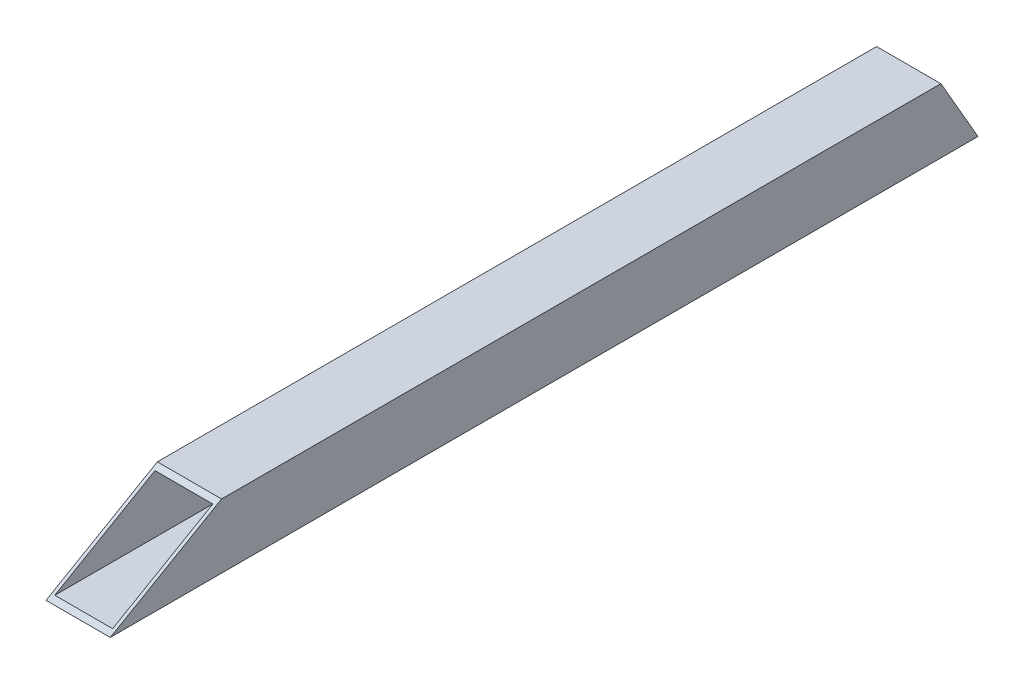
from build123d import *

# Parameters (mm, degrees)
SKETCH_1_W          = 20
SKETCH_1_H          = 20
SKETCH_1_W_2        = 18
SKETCH_1_H_2        = 18
EXTRUDE_1_DEPTH     = 270
CUT_EXTRUDE_1_DEPTH = 250


with BuildPart() as part:
    # 草图1 → 凸台-拉伸1 (new body)
    with BuildSketch(Plane.XY):
        with Locations((10, 10)):
            Rectangle(SKETCH_1_W, SKETCH_1_H)
        with Locations((10, 10)):
            Rectangle(SKETCH_1_W_2, SKETCH_1_H_2, mode=Mode.SUBTRACT)
    extrude(amount=EXTRUDE_1_DEPTH)

    # 草图2 → 切除-拉伸1 (cut)
    with BuildSketch(Plane(origin=(20, 0, 0), x_dir=(0, 0, -1), z_dir=(1, 0, 0))):
        Polygon((-270, 20), (-270, 0), (-235.358983849, 20), align=None)
        Polygon((-11.547005384, 20), (0, 20), (0, 0), align=None)
    extrude(amount=-CUT_EXTRUDE_1_DEPTH, mode=Mode.SUBTRACT)


solid = part.part
